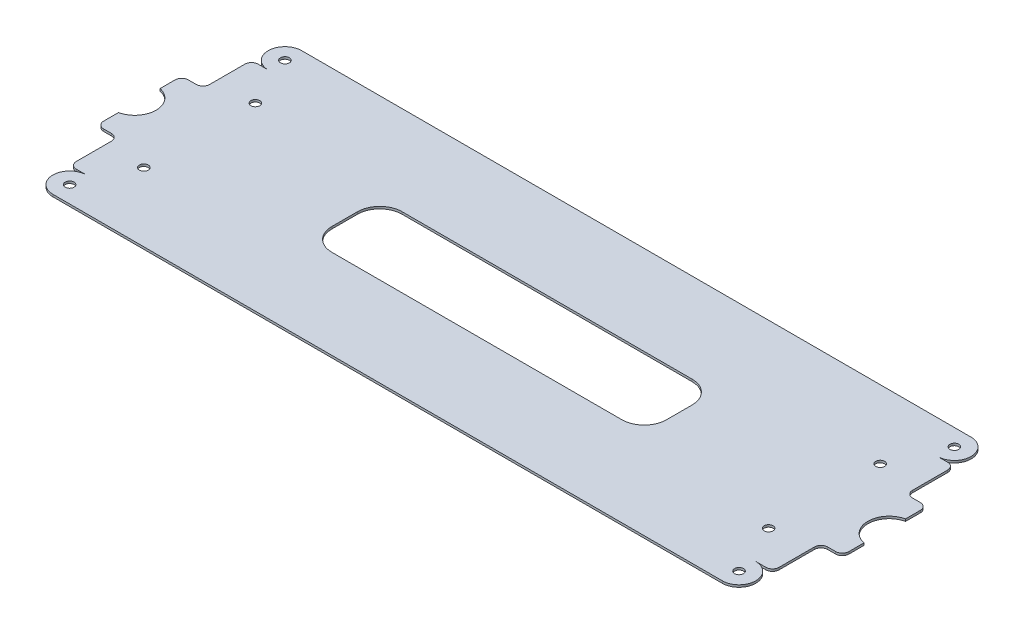
from build123d import *

# Parameters (mm, degrees)
SKETCH1_R           = 2
SKETCH1_W           = 150
SKETCH1_H           = 31.5
BOSS_EXTRUDE1_DEPTH = 1
FILLET1_R           = 10
FILLET2_R           = 3


with BuildPart() as part:
    # Sketch1 → Boss-Extrude1 (new body)
    with BuildSketch(Plane(origin=(0, 0, 0), x_dir=(1, 0, 0), z_dir=(0, 1, 0))):
        with BuildLine():
            Line((150, 55.75), (-150, 55.75))
            ThreePointArc((-150, 55.75), (-157.5, 48.25), (-150, 40.75))
            Line((-150, 40.75), (-154.5, 40.75))
            ThreePointArc((-154.5, 40.75), (-156.621320344, 39.871320344), (-157.5, 37.75))
            Line((-157.5, 37.75), (-157.5, 19))
            Line((-157.5, 19), (-167.025, 19))
            Line((-167.025, 19), (-167.025, 9.312659395))
            ThreePointArc((-167.025, 9.312659395), (-159.5, 0), (-167.025, -9.312659395))
            Line((-167.025, -9.312659395), (-167.025, -19))
            Line((-167.025, -19), (-157.5, -19))
            Line((-157.5, -19), (-157.5, -37.75))
            ThreePointArc((-157.5, -37.75), (-156.621320344, -39.871320344), (-154.5, -40.75))
            Line((-154.5, -40.75), (-150, -40.75))
            ThreePointArc((-150, -40.75), (-157.5, -48.25), (-150, -55.75))
            Line((-150, -55.75), (150, -55.75))
            ThreePointArc((150, -55.75), (157.5, -48.25), (150, -40.75))
            Line((150, -40.75), (154.5, -40.75))
            ThreePointArc((154.5, -40.75), (156.621320344, -39.871320344), (157.5, -37.75))
            Line((157.5, -37.75), (157.5, -19))
            Line((157.5, -19), (167.025, -19))
            Line((167.025, -19), (167.025, -9.312659395))
            ThreePointArc((167.025, -9.312659395), (159.5, 0), (167.025, 9.312659395))
            Line((167.025, 9.312659395), (167.025, 19))
            Line((167.025, 19), (157.5, 19))
            Line((157.5, 19), (157.5, 37.75))
            ThreePointArc((157.5, 37.75), (156.621320344, 39.871320344), (154.5, 40.75))
            Line((154.5, 40.75), (150, 40.75))
            ThreePointArc((150, 40.75), (157.5, 48.25), (150, 55.75))
        make_face()
        with Locations(Location((-150, 48.25, 0), (0, 0, 270))):
            Circle(SKETCH1_R, mode=Mode.SUBTRACT)
        with Locations(Location((150, 48.25, 0), (0, 0, 270))):
            Circle(SKETCH1_R, mode=Mode.SUBTRACT)
        with Locations(Location((150, -48.25, 0), (0, 0, 270))):
            Circle(SKETCH1_R, mode=Mode.SUBTRACT)
        with Locations(Location((-150, -48.25, 0), (0, 0, 270))):
            Circle(SKETCH1_R, mode=Mode.SUBTRACT)
        with Locations(Location((-140, 25, 0), (0, 0, 270))):
            Circle(SKETCH1_R, mode=Mode.SUBTRACT)
        with Locations(Location((-140, -25, 0), (0, 0, 270))):
            Circle(SKETCH1_R, mode=Mode.SUBTRACT)
        with Locations(Location((140, -25, 0), (0, 0, 270))):
            Circle(SKETCH1_R, mode=Mode.SUBTRACT)
        with Locations(Location((140, 25, 0), (0, 0, 270))):
            Circle(SKETCH1_R, mode=Mode.SUBTRACT)
        Rectangle(SKETCH1_W, SKETCH1_H, mode=Mode.SUBTRACT)
    extrude(amount=BOSS_EXTRUDE1_DEPTH)

    # Fillet1
    fillet1_edges = [part.edges().sort_by_distance(p)[0] for p in [
        (-75, 0.5, -15.75),
        (-75, 0.5, 15.75),
        (75, 0.5, 15.75),
        (75, 0.5, -15.75),
    ]]
    fillet(fillet1_edges, radius=FILLET1_R)

    # Fillet2
    fillet2_edges = [part.edges().sort_by_distance(p)[0] for p in [
        (-157.5, 0.5, 19),
        (-167.025, 0.5, 19),
        (-167.025, 0.5, -19),
        (-157.5, 0.5, -19),
        (157.5, 0.5, -19),
        (167.025, 0.5, -19),
        (167.025, 0.5, 19),
        (157.5, 0.5, 19),
    ]]
    fillet(fillet2_edges, radius=FILLET2_R)


solid = part.part
